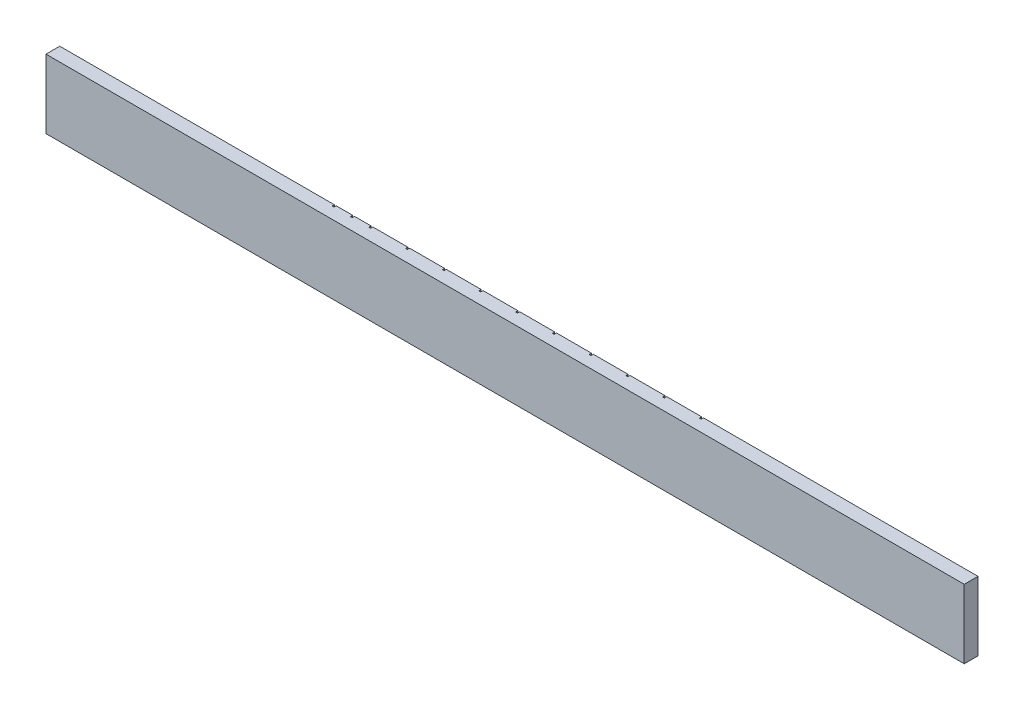
from build123d import *

# Parameters (mm, degrees)
SKETCH1_W               = 200
SKETCH1_H               = 15
BOSS_EXTRUDE1_DEPTH     = 3
SKETCH2_W               = 0.4
SKETCH2_H               = 7
CUT_EXTRUDE2_DEPTH      = 0.5
LPATTERN1_COUNT         = 11
LPATTERN1_PITCH         = 8
CUT_EXTRUDE4_DEPTH      = 0.5
CUT_EXTRUDE4_DEPTH_BACK = 0.5
SKETCH3_W               = 0.4
SKETCH3_H               = 8


with BuildPart() as part:
    # Sketch1 → Boss-Extrude1 (new body)
    with BuildSketch(Plane.XY):
        with Locations((100, 7.5)):
            Rectangle(SKETCH1_W, SKETCH1_H)
    extrude(amount=BOSS_EXTRUDE1_DEPTH)

    # Sketch2 → Cut-Extrude2 (cut, symmetric)
    with BuildSketch(Plane.XY):
        with Locations((60, 12.5)):
            Rectangle(SKETCH2_W, SKETCH2_H)
    cut_extrude2 = extrude(amount=CUT_EXTRUDE2_DEPTH, both=True, mode=Mode.SUBTRACT)

    # LPattern1: Cut-Extrude2 ×11
    with Locations(*[(i * LPATTERN1_PITCH, 0, 0) for i in range(1, LPATTERN1_COUNT)]):
        add(cut_extrude2, mode=Mode.SUBTRACT)

    # Sketch3 → Cut-Extrude4 (cut, two sides: drawn at the far end of the back side and taken through both)
    with BuildSketch(Plane.XY.offset(-CUT_EXTRUDE4_DEPTH_BACK)):
        with Locations((64, 12)):
            Rectangle(SKETCH3_W, SKETCH3_H)
    extrude(amount=CUT_EXTRUDE4_DEPTH + CUT_EXTRUDE4_DEPTH_BACK, mode=Mode.SUBTRACT)


solid = part.part
